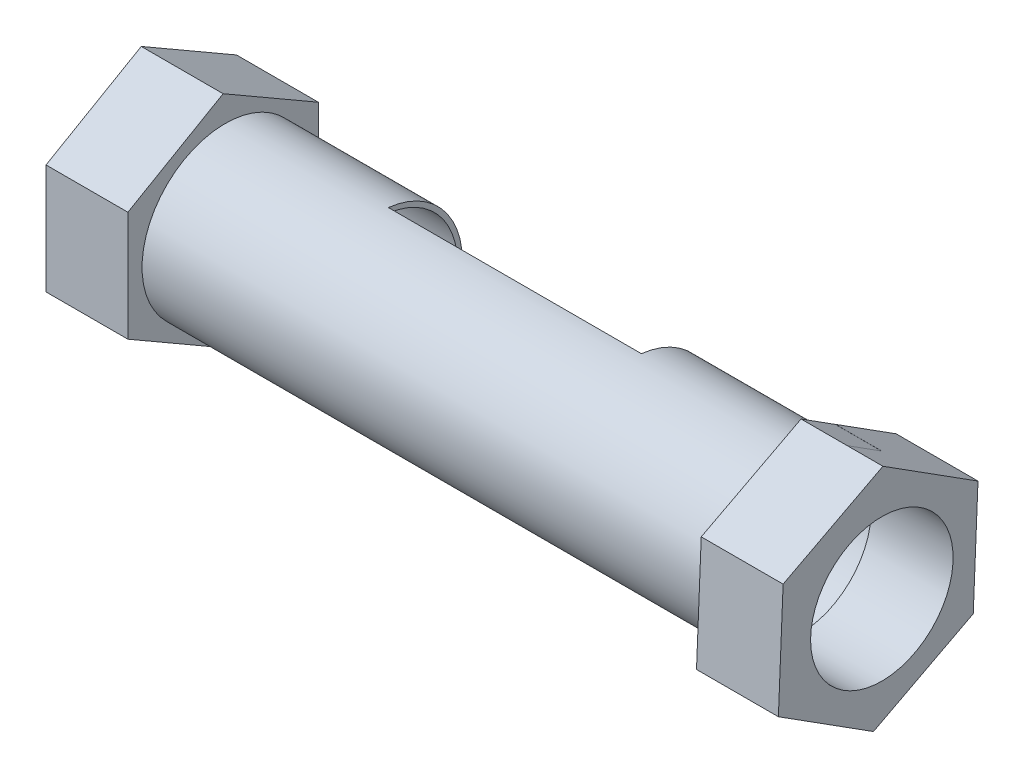
from build123d import *

# Parameters (mm, degrees)
SKETCH1_R            = 50.800375113
SKETCH1_R_2          = 47.812951641
BOSS_EXTRUDE2_DEPTH  = 350
BOSS_EXTRUDE5_DEPTH  = 50
BOSS_EXTRUDE11_DEPTH = 50
SKETCH6_R            = 44.996318031
CUT_EXTRUDE2_DEPTH   = 50
SKETCH7_R            = 43.517898498
CUT_EXTRUDE3_DEPTH   = 50
SKETCH10_W           = 19.115808835
SKETCH10_H           = 20.742352913
BOSS_EXTRUDE12_DEPTH = 50
SKETCH11_W           = 54.364903868
SKETCH11_H           = 26.370020035
CUT_EXTRUDE6_DEPTH   = 50
SKETCH12_W           = 154.555587183
SKETCH12_H           = 189.686795077
CUT_EXTRUDE7_DEPTH   = 434.835259258
CUT_EXTRUDE9_DEPTH   = 50


with BuildPart() as part:
    # Sketch1 → Boss-Extrude2 (new body)
    with BuildSketch(Plane(origin=(0, 0, 0), x_dir=(0, 0, -1), z_dir=(1, 0, 0))):
        with Locations((1.289702318, 0)):
            Circle(SKETCH1_R)
        with Locations((1.289702318, 0)):
            Circle(SKETCH1_R_2, mode=Mode.SUBTRACT)
    extrude(amount=BOSS_EXTRUDE2_DEPTH)

    # Sketch3 → Boss-Extrude5 (add)
    with BuildSketch(Plane(origin=(350, 0, 0), x_dir=(0, 0, -1), z_dir=(1, 0, 0))):
        Polygon((58.055626726, -36.855405481), (60.945530776, 31.849944836), (2.88990405, 68.705350317), (-58.055626726, 36.855405481), (-60.945530776, -31.849944836), (-2.88990405, -68.705350317), align=None)
        Polygon((29.411876605, -18.99044871), (30.315925302, 11.383738416), (4.46313198, 27.353761118), (-22.293710039, 12.949596693), (-23.197758737, -17.424590433), (2.655034585, -33.394613135), align=None, mode=Mode.SUBTRACT)
    extrude(amount=BOSS_EXTRUDE5_DEPTH)

    # Sketch5 → Boss-Extrude11 (add)
    with BuildSketch(Plane.ZY):
        Polygon((0, -67.161353017), (58.163437865, -33.580676508), (58.163437865, 33.580676508), (0, 67.161353017), (-58.163437865, 33.580676508), (-58.163437865, -33.580676508), align=None)
    extrude(amount=BOSS_EXTRUDE11_DEPTH)

    # Sketch6 → Cut-Extrude2 (cut)
    with BuildSketch(Plane(origin=(0, 0, 0), x_dir=(0, 0, -1), z_dir=(1, 0, 0))):
        with Locations((2.167278034, 0)):
            Circle(SKETCH6_R)
    extrude(amount=-CUT_EXTRUDE2_DEPTH, mode=Mode.SUBTRACT)

    # Sketch7 → Cut-Extrude3 (cut)
    with BuildSketch(Plane.ZY.offset(-350)):
        with Locations((-2.231478452, -1.09442532)):
            Circle(SKETCH7_R)
    extrude(amount=-CUT_EXTRUDE3_DEPTH, mode=Mode.SUBTRACT)

    # Sketch10 → Boss-Extrude12 (add)
    with BuildSketch(Plane(origin=(0, 50.277647577, -31.917717413), x_dir=(1, 0, 0), z_dir=(0, 0.8442477544511112, -0.5359531034561291))):
        with Locations((368.704344308, -19.961055073)):
            Rectangle(SKETCH10_W, SKETCH10_H)
    extrude(amount=BOSS_EXTRUDE12_DEPTH)

    # Sketch11 → Cut-Extrude6 (cut)
    with BuildSketch(Plane(origin=(378.262248725, 0, 0), x_dir=(0, 0, -1), z_dir=(1, 0, 0))):
        with Locations((35.769872333, 101.000183765)):
            Rectangle(SKETCH11_W, SKETCH11_H)
    extrude(amount=-CUT_EXTRUDE6_DEPTH, mode=Mode.SUBTRACT)

    # Sketch12 → Cut-Extrude7 (cut, through all)
    with BuildSketch(Plane(origin=(0, 87.815173747, 0), x_dir=(1, 0, 0), z_dir=(0, 1, 0))):
        with Locations((171.244586456, 101.756488253)):
            Rectangle(SKETCH12_W, SKETCH12_H)
    extrude(amount=-CUT_EXTRUDE7_DEPTH, mode=Mode.SUBTRACT)

    # Sketch13 → Cut-Extrude9 (cut)
    with BuildSketch(Plane(origin=(378.262248725, 0, 0), x_dir=(0, 0, -1), z_dir=(1, 0, 0))):
        Polygon((2.767415971, 94.353770173), (53.126909072, 94.353770173), (23.904702859, 55.316039855), (1.784436984, 69.406798444), align=None)
    extrude(amount=-CUT_EXTRUDE9_DEPTH, mode=Mode.SUBTRACT)


solid = part.part
